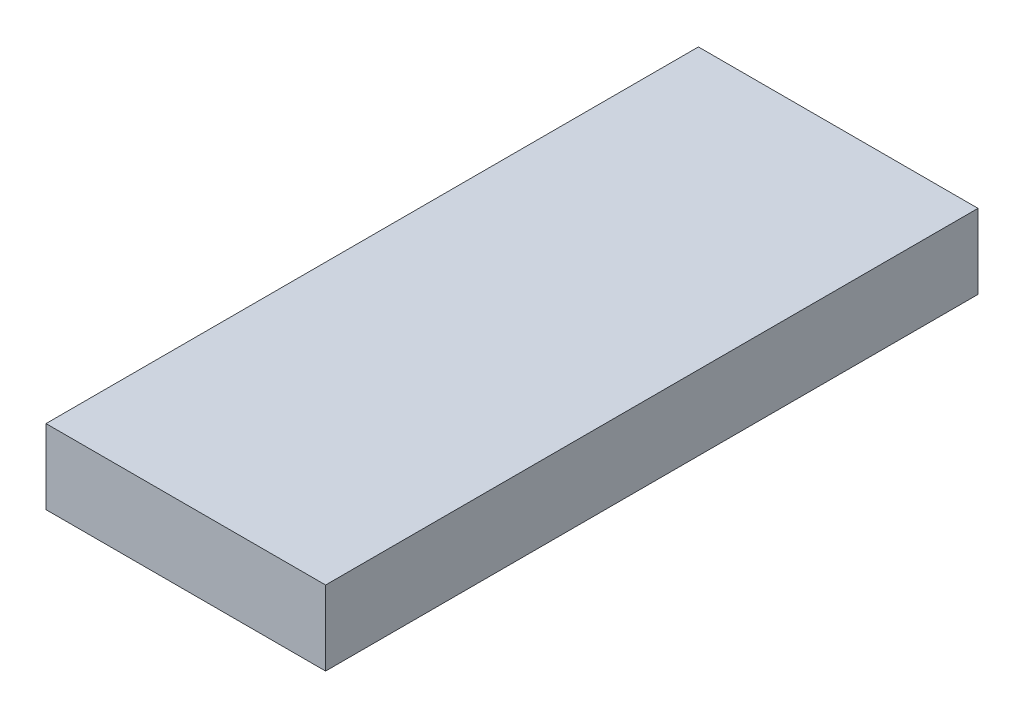
from build123d import *

# Parameters (mm, degrees)
SKETCH1_W           = 7.5
SKETCH1_H           = 17.5
BOSS_EXTRUDE1_DEPTH = 2


with BuildPart() as part:
    # Sketch1 → Boss-Extrude1 (new body)
    with BuildSketch(Plane(origin=(0, 0, 0), x_dir=(1, 0, 0), z_dir=(0, 1, 0))):
        with Locations((3.75, 8.75)):
            Rectangle(SKETCH1_W, SKETCH1_H)
    extrude(amount=BOSS_EXTRUDE1_DEPTH)


solid = part.part
